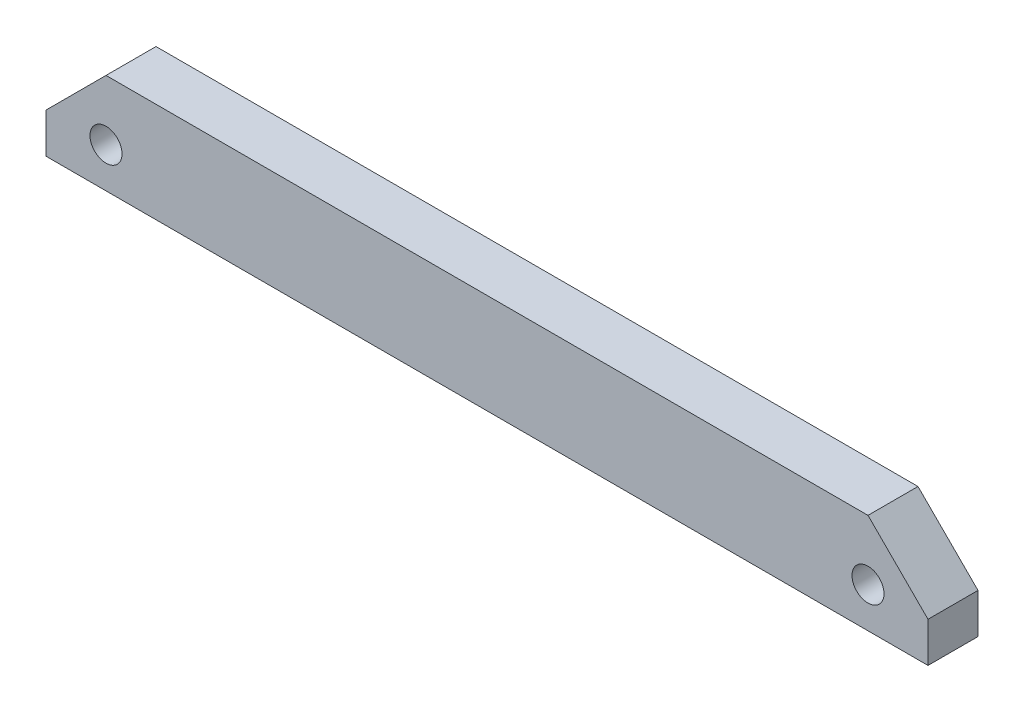
from build123d import *

# Parameters (mm, degrees)
DODANIE_WYCI_GNI_CIE1_DEPTH = 5
SZKIC2_R                    = 1.6
WYTNIJ_WYCI_GNI_CIE1_DEPTH  = 46.495164578


with BuildPart() as part:
    # Szkic1 → Dodanie-wyciągnięcie1 (new body)
    with BuildSketch(Plane.XY):
        Polygon((-44.1, 0), (44.1, 0), (44.1, 4), (38.1, 10), (-38.1, 10), (-44.1, 4), align=None)
    extrude(amount=DODANIE_WYCI_GNI_CIE1_DEPTH)

    # Szkic2 → Wytnij-wyciągnięcie1 (cut, through all)
    with BuildSketch(Plane.XY.offset(5)):
        with Locations((-38.1, 4)):
            Circle(SZKIC2_R)
        with Locations(Location((38.1, 4, 0), (0, 0, 180))):
            Circle(SZKIC2_R)
    extrude(amount=-WYTNIJ_WYCI_GNI_CIE1_DEPTH, mode=Mode.SUBTRACT)


solid = part.part
